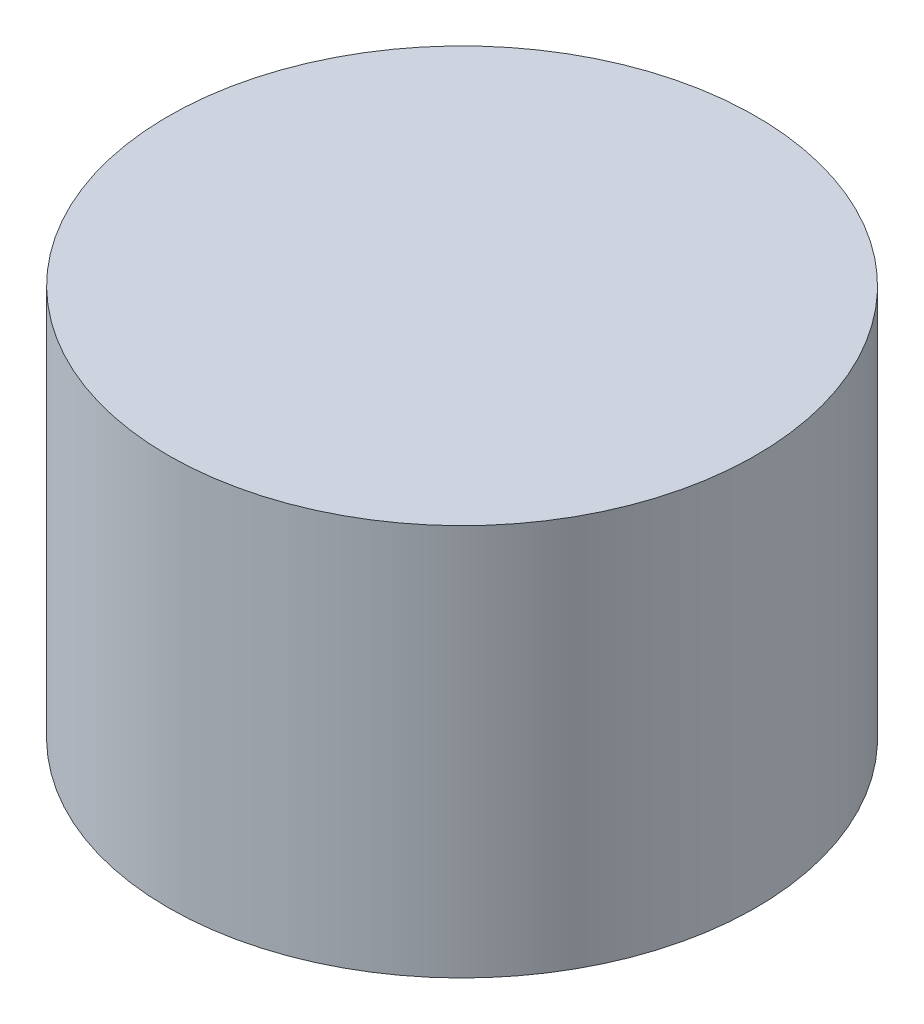
from build123d import *

# Parameters (mm, degrees)
SKETCH_1_R      = 3
EXTRUDE_1_DEPTH = 4


with BuildPart() as part:
    # 草圖1 → 填料-伸長1 (new body)
    with BuildSketch(Plane(origin=(0, 0, 0), x_dir=(1, 0, 0), z_dir=(0, 1, 0))):
        with Locations(Location((0, 0, 0), (0, 0, 270))):
            Circle(SKETCH_1_R)
    extrude(amount=EXTRUDE_1_DEPTH)


solid = part.part
